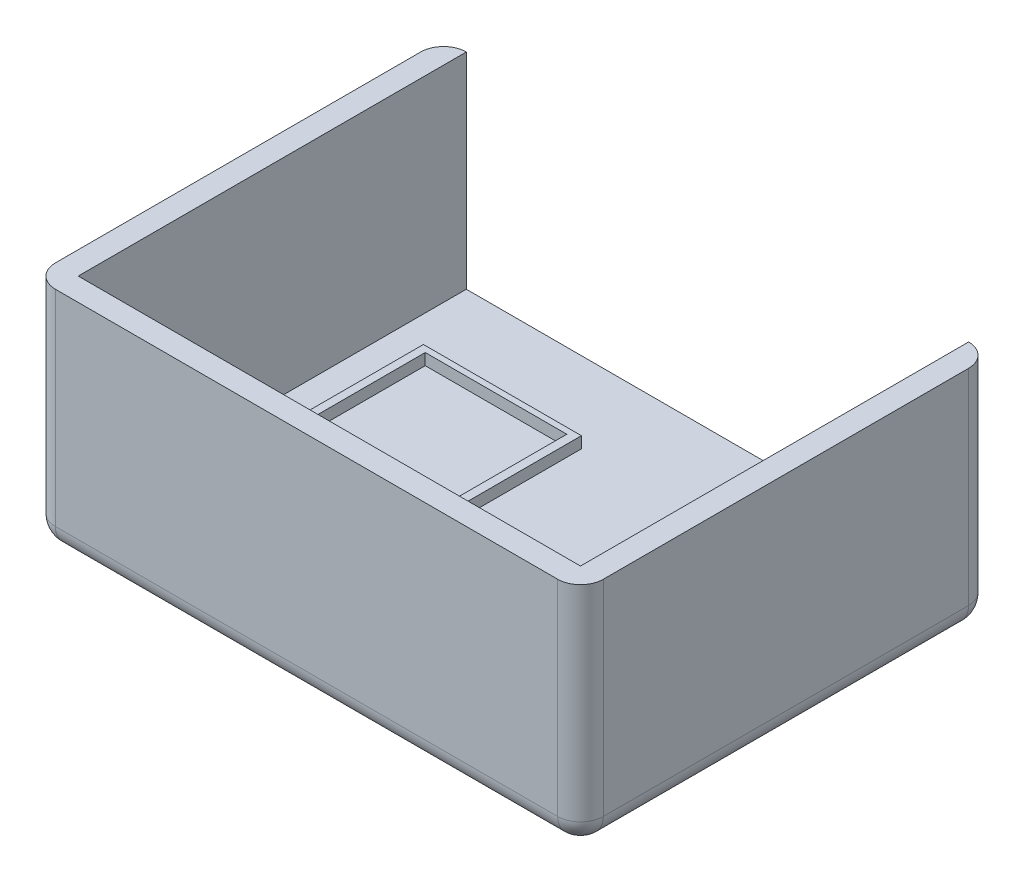
from build123d import *

# Parameters (mm, degrees)
SKETCH2_W           = 240
SKETCH2_H           = 180
BOSS_EXTRUDE1_DEPTH = 100
SHELL1_T            = -10
FILLET3_R           = 10
FILLET4_R           = 10
SKETCH3_W           = 220
SKETCH3_H           = 90
CUT_EXTRUDE1_DEPTH  = 10
SKETCH6_W           = 69.206685732
SKETCH6_H           = 97.92746031
SKETCH6_W_2         = 62
SKETCH6_H_2         = 92
SKETCH6_W_3         = 84.432156592
SKETCH6_H_3         = 50.520880584
SKETCH6_W_4         = 76
SKETCH6_H_4         = 41
BOSS_EXTRUDE2_DEPTH = 5


with BuildPart() as part:
    # Sketch2 → Boss-Extrude1 (new body)
    with BuildSketch(Plane(origin=(0, 0, 0), x_dir=(1, 0, 0), z_dir=(0, 1, 0))):
        with Locations((91.04519774, -71.073446328)):
            Rectangle(SKETCH2_W, SKETCH2_H)
    extrude(amount=BOSS_EXTRUDE1_DEPTH)

    # Shell1
    shell1_openings = [part.faces().sort_by_distance(p)[0] for p in [
        (91.04519774, 100, 71.073446328),
    ]]
    offset(amount=SHELL1_T, openings=shell1_openings, kind=Kind.INTERSECTION)

    # Fillet3
    fillet3_edges = [part.edges().sort_by_distance(p)[0] for p in [
        (-28.95480226, 50, -18.926553672),
        (211.04519774, 50, -18.926553672),
        (211.04519774, 50, 161.073446328),
        (-28.95480226, 50, 161.073446328),
    ]]
    fillet(fillet3_edges, radius=FILLET3_R)

    # Fillet4
    fillet4_edges = [part.edges().sort_by_distance(p)[0] for p in [
        (-28.95480226, 0, 71.073446328),
        (91.04519774, 0, -18.926553672),
        (211.04519774, 0, 71.073446328),
        (91.04519774, 0, 161.073446328),
        (208.116265552, 0, 158.14451414),
        (208.116265552, 0, -15.997621484),
        (-26.025870072, 0, 158.14451414),
        (-26.025870072, 0, -15.997621484),
    ]]
    fillet(fillet4_edges, radius=FILLET4_R)

    # Sketch3 → Cut-Extrude1 (cut)
    with BuildSketch(Plane(origin=(0, 0, -18.926553672), x_dir=(-1, 0, 0), z_dir=(0, 0, -1))):
        with Locations((-91.04519774, 55)):
            Rectangle(SKETCH3_W, SKETCH3_H)
    extrude(amount=-CUT_EXTRUDE1_DEPTH, mode=Mode.SUBTRACT)

    # Sketch6 → Boss-Extrude2 (add)
    # profile 1 of 2: a face of its own
    with BuildSketch(Plane(origin=(0, 10, 0), x_dir=(1, 0, 0), z_dir=(0, 1, 0))):
        with Locations((32.200405027, -65.396277703)):
            Rectangle(SKETCH6_W, SKETCH6_H)
        with Locations((32.04519774, -65.073446328)):
            Rectangle(SKETCH6_W_2, SKETCH6_H_2, mode=Mode.SUBTRACT)
    # profile 2 of 2: a face of its own
    with BuildSketch(Plane(origin=(0, 10, 0), x_dir=(1, 0, 0), z_dir=(0, 1, 0))):
        with Locations((152.6200382, -98.44247014)):
            Rectangle(SKETCH6_W_3, SKETCH6_H_3)
        with Locations((152.556361047, -98.18046442)):
            Rectangle(SKETCH6_W_4, SKETCH6_H_4, mode=Mode.SUBTRACT)
    extrude(amount=BOSS_EXTRUDE2_DEPTH)


solid = part.part
